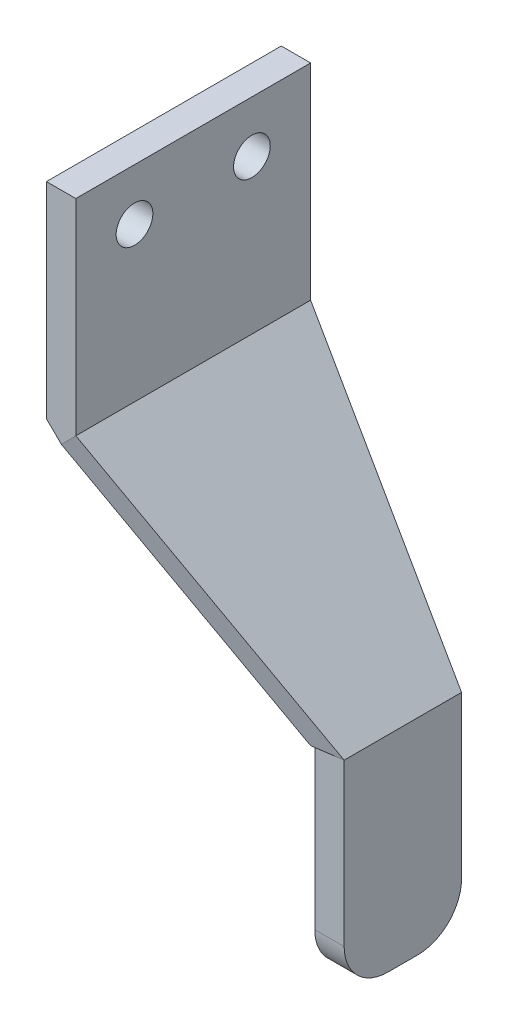
from build123d import *

# Parameters (mm, degrees)
BOSS_EXTRU_1_DEPTH      = 8
ESQUISSE2_R             = 0.625
ENL_V_MAT_EXTRU_2_DEPTH = 8
ENL_V_MAT_EXTRU_4_DEPTH = 8
ESQUISSE4_W             = 2
ESQUISSE4_H             = 7
ENL_V_MAT_EXTRU_6_DEPTH = 8
CONG_4_R                = 1.5
CONG_7_R                = 1.5


with BuildPart() as part:
    # Esquisse1 → Boss.-Extru.1 (new body)
    with BuildSketch(Plane.XY):
        Polygon((-4.284999929, 10.5), (-4.284999929, 3.5), (2.8564285, -3.5), (2.8564285, -10.5), (3.8564285, -10.5), (3.8564285, -3.5), (-3.284999929, 3.5), (-3.284999929, 10.5), align=None)
    extrude(amount=BOSS_EXTRU_1_DEPTH)

    # Esquisse2 → Enlèv. mat.-Extru.2 (cut)
    with BuildSketch(Plane(origin=(-3.284999929, 0, 0), x_dir=(0, 0, -1), z_dir=(1, 0, 0))):
        with Locations(Location((-6, 8.744627622, 0), (0, 0, 90))):
            Circle(ESQUISSE2_R)
        with Locations(Location((-2, 8.744627622, 0), (0, 0, 90))):
            Circle(ESQUISSE2_R)
    extrude(amount=-ENL_V_MAT_EXTRU_2_DEPTH, mode=Mode.SUBTRACT)

    # Esquisse3 → Enlèv. mat.-Extru.4 (cut)
    with BuildSketch(Plane(origin=(0.14, 0.142828569, 0), x_dir=(0.7141428428542851, -0.7, 0), z_dir=(0.7, 0.7141428428542851, 0))):
        Polygon((-4.795959188, -8), (5.204040812, -6), (5.204040812, -8), align=None)
        Polygon((-4.795959188, 0), (5.204040812, -2), (5.204040812, 0), align=None)
    extrude(amount=-ENL_V_MAT_EXTRU_4_DEPTH, mode=Mode.SUBTRACT)

    # Esquisse4 → Enlèv. mat.-Extru.6 (cut)
    with BuildSketch(Plane(origin=(3.8564285, 0, 0), x_dir=(0, 0, -1), z_dir=(1, 0, 0))):
        with Locations((-7, -7)):
            Rectangle(ESQUISSE4_W, ESQUISSE4_H)
        with Locations((-1, -7)):
            Rectangle(ESQUISSE4_W, ESQUISSE4_H)
    extrude(amount=-ENL_V_MAT_EXTRU_6_DEPTH, mode=Mode.SUBTRACT)

    # Congé4
    cong_4_edges = [part.edges().sort_by_distance(p)[0] for p in [
        (3.3564285, -10.5, 2),
    ]]
    fillet(cong_4_edges, radius=CONG_4_R)

    # Congé7
    cong_7_edges = [part.edges().sort_by_distance(p)[0] for p in [
        (3.3564285, -10.5, 6),
    ]]
    fillet(cong_7_edges, radius=CONG_7_R)


solid = part.part
